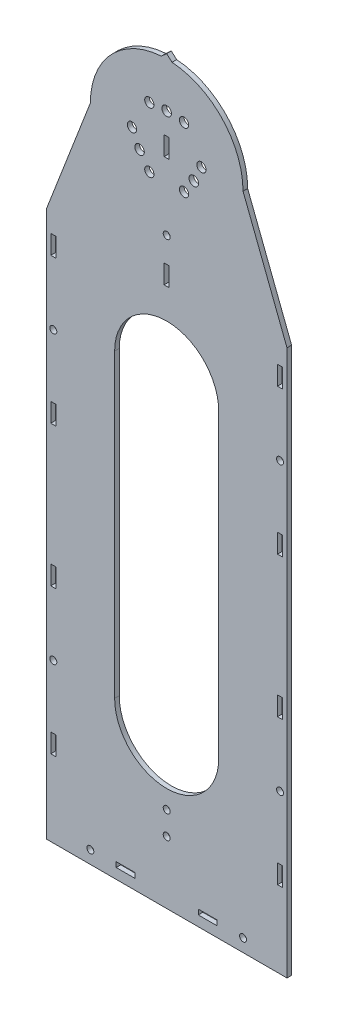
from build123d import *

# Parameters (mm, degrees)
SKETCH_1_R      = 1.5
SKETCH_1_R_2    = 2
SKETCH_1_R_3    = 2.05
SKETCH_1_W      = 8.2
SKETCH_1_H      = 2.2
SKETCH_1_W_2    = 2.2
SKETCH_1_H_2    = 8.2
EXTRUDE_1_DEPTH = 2


with BuildPart() as part:
    # 草图1 → 凸台-拉伸1 (new body)
    with BuildSketch(Plane.XY):
        with BuildLine():
            Line((-51.22603831, 230.027402263), (-51.22603831, 124.402402263))
            Line((-51.22603831, 124.402402263), (-51.22603831, 0.652402263))
            Line((-51.22603831, 0.652402263), (-51.22603831, -5.881910062))
            Line((-51.22603831, -5.881910062), (-17.97603831, -5.881910062))
            Line((-17.97603831, -5.881910062), (19.52396169, -5.881910062))
            Line((19.52396169, -5.881910062), (52.77396169, -5.881910062))
            Line((52.77396169, -5.881910062), (52.77396169, 0.652402263))
            Line((52.77396169, 0.652402263), (52.77396169, 124.402402263))
            Line((52.77396169, 124.402402263), (52.77396169, 230.027402263))
            Line((52.77396169, 230.027402263), (33.77396169, 279.152402263))
            ThreePointArc((33.77396169, 279.152402263), (24.908633844, 301.658348145), (3.075925324, 312.072015922))
            Line((3.075925324, 312.072015922), (0.77396169, 314.152402263))
            Line((0.77396169, 314.152402263), (-1.528001943, 312.072015922))
            ThreePointArc((-1.528001943, 312.072015922), (-23.360710463, 301.658348145), (-32.22603831, 279.152402263))
            Line((-32.22603831, 279.152402263), (-51.22603831, 230.027402263))
        make_face()
        with Locations((-32.22603831, -0.347597737)):
            Circle(SKETCH_1_R, mode=Mode.SUBTRACT)
        with Locations((-48.22603831, 62.527402263)):
            Circle(SKETCH_1_R, mode=Mode.SUBTRACT)
        with Locations((-48.22603831, 186.277402263)):
            Circle(SKETCH_1_R, mode=Mode.SUBTRACT)
        with Locations((33.77396169, -0.347597737)):
            Circle(SKETCH_1_R, mode=Mode.SUBTRACT)
        with Locations((49.77396169, 62.527402263)):
            Circle(SKETCH_1_R, mode=Mode.SUBTRACT)
        with Locations((49.77396169, 186.277402263)):
            Circle(SKETCH_1_R, mode=Mode.SUBTRACT)
        with Locations((0.77396169, 21.118089938)):
            Circle(SKETCH_1_R, mode=Mode.SUBTRACT)
        with Locations((0.77396169, 31.118089938)):
            Circle(SKETCH_1_R, mode=Mode.SUBTRACT)
        with Locations((-14.22603831, 279.152402263)):
            Circle(SKETCH_1_R_2, mode=Mode.SUBTRACT)
        with Locations((-6.72603831, 292.14278332)):
            Circle(SKETCH_1_R_2, mode=Mode.SUBTRACT)
        with Locations((8.27396169, 292.14278332)):
            Circle(SKETCH_1_R_2, mode=Mode.SUBTRACT)
        with Locations((15.77396169, 279.152402263)):
            Circle(SKETCH_1_R_2, mode=Mode.SUBTRACT)
        with Locations((8.27396169, 266.162021207)):
            Circle(SKETCH_1_R_2, mode=Mode.SUBTRACT)
        with Locations((-6.72603831, 266.162021207)):
            Circle(SKETCH_1_R_2, mode=Mode.SUBTRACT)
        with Locations((0.77396169, 292.682402263)):
            Circle(SKETCH_1_R_3, mode=Mode.SUBTRACT)
        with Locations((12.491285404, 272.387402263)):
            Circle(SKETCH_1_R_3, mode=Mode.SUBTRACT)
        with Locations((-10.943362023, 272.387402263)):
            Circle(SKETCH_1_R_3, mode=Mode.SUBTRACT)
        with Locations((0.77396169, 246.152402263)):
            Circle(SKETCH_1_R, mode=Mode.SUBTRACT)
        with Locations((-16.97603831, -0.347597737)):
            Rectangle(SKETCH_1_W, SKETCH_1_H, mode=Mode.SUBTRACT)
        with Locations((18.52396169, -0.347597737)):
            Rectangle(SKETCH_1_W, SKETCH_1_H, mode=Mode.SUBTRACT)
        with BuildLine():
            Line((23.27396169, 191.554247886), (23.27396169, 61.554247886))
            ThreePointArc((23.27396169, 61.554247886), (0.77396169, 39.054247886), (-21.72603831, 61.554247886))
            Line((-21.72603831, 61.554247886), (-21.72603831, 191.554247886))
            ThreePointArc((-21.72603831, 191.554247886), (0.77396169, 214.054247886), (23.27396169, 191.554247886))
        make_face(mode=Mode.SUBTRACT)
        with Locations((-48.22603831, 217.714902263)):
            Rectangle(SKETCH_1_W_2, SKETCH_1_H_2, mode=Mode.SUBTRACT)
        with Locations((-48.22603831, 154.839902263)):
            Rectangle(SKETCH_1_W_2, SKETCH_1_H_2, mode=Mode.SUBTRACT)
        with Locations((-48.22603831, 93.964902263)):
            Rectangle(SKETCH_1_W_2, SKETCH_1_H_2, mode=Mode.SUBTRACT)
        with Locations((-48.22603831, 31.089902263)):
            Rectangle(SKETCH_1_W_2, SKETCH_1_H_2, mode=Mode.SUBTRACT)
        with Locations((49.77396169, 31.089902263)):
            Rectangle(SKETCH_1_W_2, SKETCH_1_H_2, mode=Mode.SUBTRACT)
        with Locations((49.77396169, 93.964902263)):
            Rectangle(SKETCH_1_W_2, SKETCH_1_H_2, mode=Mode.SUBTRACT)
        with Locations((49.77396169, 154.839902263)):
            Rectangle(SKETCH_1_W_2, SKETCH_1_H_2, mode=Mode.SUBTRACT)
        with Locations((49.77396169, 217.714902263)):
            Rectangle(SKETCH_1_W_2, SKETCH_1_H_2, mode=Mode.SUBTRACT)
        with Locations((0.77396169, 231.152402263)):
            Rectangle(SKETCH_1_W_2, SKETCH_1_H_2, mode=Mode.SUBTRACT)
        with Locations((0.77396169, 279.152402263)):
            Rectangle(SKETCH_1_W_2, SKETCH_1_H_2, mode=Mode.SUBTRACT)
    extrude(amount=EXTRUDE_1_DEPTH)


solid = part.part
